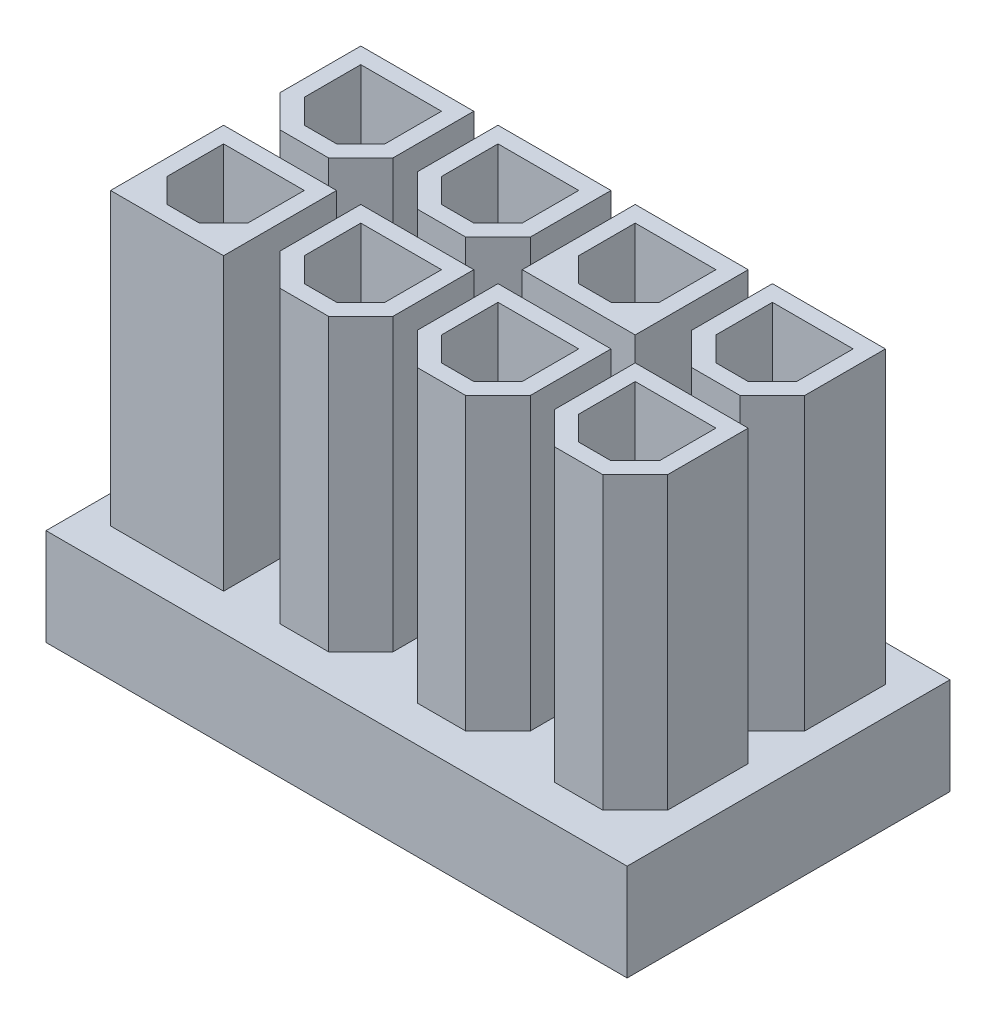
from build123d import *

# Parameters (mm, degrees)
SKIZZE1_W                       = 10
SKIZZE1_H                       = 11
AUFSATZ_LINEAR_AUSTRAGEN1_DEPTH = 9
SKIZZE2_W                       = 1.5
SKIZZE2_H                       = 1
AUFSATZ_LINEAR_AUSTRAGEN2_DEPTH = 9
SKIZZE6_W                       = 3.75
SKIZZE6_H                       = 3.75
SCHNITT_LINEAR_AUSTRAGEN2_DEPTH = 10
LINEARES_MUSTER1_COUNT          = 4
LINEARES_MUSTER1_PITCH          = 4.25
LINEARES_MUSTER1_COUNT_DIR2     = 2
LINEARES_MUSTER1_PITCH_DIR2     = 4.25
SKIZZE7_W                       = 3.5
SKIZZE7_H                       = 3.5
AUFSATZ_LINEAR_AUSTRAGEN5_DEPTH = 9
LINEARES_MUSTER2_COUNT          = 3
LINEARES_MUSTER2_PITCH          = 4.25
LINEARES_MUSTER2_COUNT_DIR2     = 2
LINEARES_MUSTER2_PITCH_DIR2     = 4.25
AUFSATZ_LINEAR_AUSTRAGEN7_DEPTH = 9
LINEARES_MUSTER4_COUNT          = 4
LINEARES_MUSTER4_PITCH          = 4.25
LINEARES_MUSTER4_COUNT_DIR2     = 2
LINEARES_MUSTER4_PITCH_DIR2     = 4.25
SCHNITT_LINEAR_AUSTRAGEN4_DEPTH = 23.874658467
LINEARES_MUSTER6_COUNT          = 4
LINEARES_MUSTER6_PITCH          = 4.25
LINEARES_MUSTER6_COUNT_DIR2     = 2
LINEARES_MUSTER6_PITCH_DIR2     = 4.25
SKETCH_3_W                      = 20.071123044
SKETCH_3_H                      = 21.030403289
CUT_EXTRUDE_1_DEPTH             = 8


with BuildPart() as part:
    # Skizze1 → Aufsatz-Linear austragen1 (new, symmetric)
    with BuildSketch(Plane(origin=(0, 0, 0), x_dir=(0, 0, -1), z_dir=(1, 0, 0))):
        with Locations((0, 5.5)):
            Rectangle(SKIZZE1_W, SKIZZE1_H)
    extrude(amount=AUFSATZ_LINEAR_AUSTRAGEN1_DEPTH, both=True)

    # Skizze2 → Aufsatz-Linear austragen2 (add, symmetric)
    with BuildSketch(Plane(origin=(0, 0, 0), x_dir=(0, 0, -1), z_dir=(1, 0, 0))):
        with Locations((-5.75, 0.5)):
            Rectangle(SKIZZE2_W, SKIZZE2_H)
        with Locations((5.75, 0.5)):
            Rectangle(SKIZZE2_W, SKIZZE2_H)
    extrude(amount=AUFSATZ_LINEAR_AUSTRAGEN2_DEPTH, both=True)

    # Skizze6 → Schnitt-Linear austragen2 (cut)
    with BuildSketch(Plane.XZ):
        with Locations((-6.375, -2.125)):
            Rectangle(SKIZZE6_W, SKIZZE6_H)
    schnitt_linear_austragen2 = extrude(amount=-SCHNITT_LINEAR_AUSTRAGEN2_DEPTH, mode=Mode.SUBTRACT)

    # Lineares Muster1: Schnitt-Linear austragen2 4 × 2
    with Locations(*[(i * LINEARES_MUSTER1_PITCH, 0, j * LINEARES_MUSTER1_PITCH_DIR2) for i in range(LINEARES_MUSTER1_COUNT) for j in range(LINEARES_MUSTER1_COUNT_DIR2) if (i, j) != (0, 0)]):
        add(schnitt_linear_austragen2, mode=Mode.SUBTRACT)

    # Skizze7 → Aufsatz-Linear austragen5 (add)
    with BuildSketch(Plane(origin=(0, 11, 0), x_dir=(1, 0, 0), z_dir=(0, 1, 0))):
        with Locations((-6.375, -2.125)):
            Rectangle(SKIZZE7_W, SKIZZE7_H)
    aufsatz_linear_austragen5 = extrude(amount=AUFSATZ_LINEAR_AUSTRAGEN5_DEPTH)

    # Lineares Muster2: Aufsatz-Linear austragen5 3 × 2, 4 skipped
    with Locations(*[(i * LINEARES_MUSTER2_PITCH, 0, -j * LINEARES_MUSTER2_PITCH_DIR2) for i in range(LINEARES_MUSTER2_COUNT) for j in range(LINEARES_MUSTER2_COUNT_DIR2) if (i, j) not in ((0, 0), (0, 1), (1, 0), (1, 1), (2, 0))]):
        add(aufsatz_linear_austragen5)

    # Skizze10 → Aufsatz-Linear austragen7 (add)
    with BuildSketch(Plane(origin=(0, 11, 0), x_dir=(1, 0, 0), z_dir=(0, 1, 0))):
        Polygon((-4.625, 1.375), (-5.625, 0.375), (-7.125, 0.375), (-8.125, 1.375), (-8.125, 3.875), (-4.625, 3.875), align=None)
    aufsatz_linear_austragen7 = extrude(amount=AUFSATZ_LINEAR_AUSTRAGEN7_DEPTH)

    # Lineares Muster4: Aufsatz-Linear austragen7 4 × 2, 2 skipped
    with Locations(*[(i * LINEARES_MUSTER4_PITCH, 0, j * LINEARES_MUSTER4_PITCH_DIR2) for i in range(LINEARES_MUSTER4_COUNT) for j in range(LINEARES_MUSTER4_COUNT_DIR2) if (i, j) not in ((0, 0), (0, 1), (2, 0))]):
        add(aufsatz_linear_austragen7)

    # Skizze12 → Schnitt-Linear austragen4 (cut, through all)
    with BuildSketch(Plane(origin=(0, 20, 0), x_dir=(1, 0, 0), z_dir=(0, 1, 0))):
        Polygon((-5.875, 0.875), (-5.125, 1.625), (-5.125, 3.375), (-7.625, 3.375), (-7.625, 1.625), (-6.875, 0.875), align=None)
    schnitt_linear_austragen4 = extrude(amount=-SCHNITT_LINEAR_AUSTRAGEN4_DEPTH, mode=Mode.SUBTRACT)

    # Lineares Muster6: Schnitt-Linear austragen4 4 × 2
    with Locations(*[(i * LINEARES_MUSTER6_PITCH, 0, j * LINEARES_MUSTER6_PITCH_DIR2) for i in range(LINEARES_MUSTER6_COUNT) for j in range(LINEARES_MUSTER6_COUNT_DIR2) if (i, j) != (0, 0)]):
        add(schnitt_linear_austragen4, mode=Mode.SUBTRACT)

    # 草图3 → 切除-拉伸1 (cut)
    with BuildSketch(Plane(origin=(0, 0, 0), x_dir=(-1, 0, 0), z_dir=(0, -1, 0))):
        with Locations((-0.428033297, -0.424589463)):
            Rectangle(SKETCH_3_W, SKETCH_3_H)
    extrude(amount=-CUT_EXTRUDE_1_DEPTH, mode=Mode.SUBTRACT)


solid = part.part
